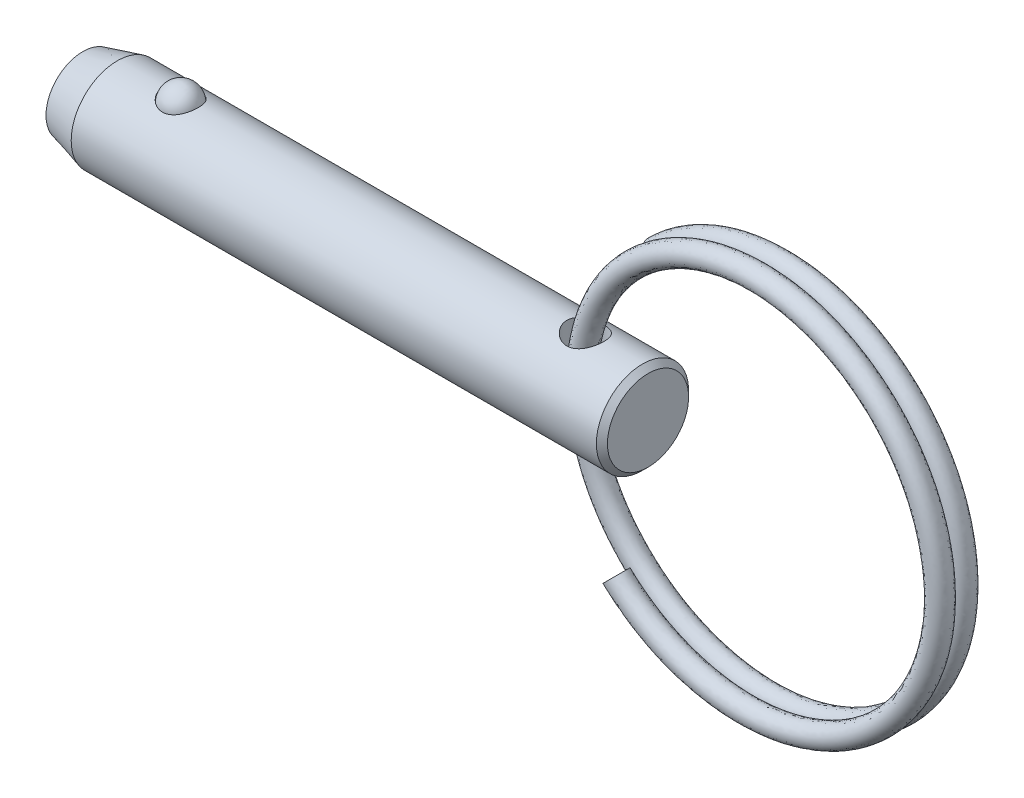
from build123d import *

# Parameters (mm, degrees)
SKETCH4_W          = 1.27
SKETCH4_H          = 6.35
SWEEP1_PITCH       = 1.5494
SWEEP1_HEIGHT      = 1.355725
SWEEP1_RADIUS      = 13.462
SKETCH6_R          = 0.762
SWEEP2_PITCH       = 1.5494
SWEEP2_HEIGHT      = 1.355725
SWEEP2_RADIUS      = 13.462
SWEEP2_START_ANGLE = -180
SKETCH6_2_R        = 0.762


with BuildPart() as part:
    # Sketch1 → Revolve1 (revolve)
    with BuildSketch(Plane.XY, mode=Mode.PRIVATE) as revolve1_sk:
        Polygon((5.588, 2.794), (5.207, 3.175), (-30.954947737, 3.175), (-33.3248, 2.54), (-33.3248, 0), (5.588, 0), align=None)
    revolve(revolve1_sk.sketch.rotate(Axis((5.588, 0, 0), (1, 0, 0)), 90), axis=Axis((5.588, 0, 0), (1, 0, 0)))

    # Sketch2 → Cut-Revolve1 (revolve, cut)
    with BuildSketch(Plane.XY):
        with BuildLine():
            Line((-25.332982051, 2.8575), (-27.847582051, 2.8575))
            ThreePointArc((-27.847582051, 2.8575), (-26.590282051, 4.1148), (-25.332982051, 2.8575))
        make_face()
    revolve(axis=Axis((-25.332982051, 2.8575, 0), (1, 0, 0)), mode=Mode.SUBTRACT)

    # Sketch4 → Cut-Revolve2 (revolve, cut)
    with BuildSketch(Plane.XY, mode=Mode.PRIVATE) as cut_revolve2_sk:
        with Locations((1.905, 0)):
            Rectangle(SKETCH4_W, SKETCH4_H)
    revolve(cut_revolve2_sk.sketch.rotate(Axis((1.27, -3.175, 0), (0, 1, 0)), 90), axis=Axis((1.27, -3.175, 0), (0, 1, 0)), mode=Mode.SUBTRACT)


with BuildPart() as body_2:
    # Sketch3 → Revolve2 (revolve)
    with BuildSketch(Plane.XY):
        with BuildLine():
            Line((-25.358382051, 2.8575), (-27.822182051, 2.8575))
            ThreePointArc((-27.822182051, 2.8575), (-26.590282051, 4.0894), (-25.358382051, 2.8575))
        make_face()
    revolve(axis=Axis((-25.358382051, 2.8575, 0), (1, 0, 0)))


with BuildPart() as body_3:
    # Sweep1: sweep along a helix
    with BuildLine() as sweep1_path:
        Helix(SWEEP1_PITCH, SWEEP1_HEIGHT, SWEEP1_RADIUS, center=(13.755025091, 0, 0), direction=(0, 0, -1), lefthand=True)
    # Sketch6 → Sweep1 (sweep)
    with BuildSketch(Plane(origin=(114.003847968, 0, 0), x_dir=(0, 0, -1), z_dir=(0, 1, 0))):
        with Locations((0, 112.948822877)):
            Circle(SKETCH6_R)
    sweep(path=sweep1_path.line, is_frenet=True)

    # Sweep2: sweep along a helix
    with BuildLine() as sweep2_path:
        add(Helix(SWEEP2_PITCH, SWEEP2_HEIGHT, SWEEP2_RADIUS, center=(13.755025091, 0, 0), direction=(0, 0, 1), lefthand=True, mode=Mode.PRIVATE).rotate(Axis((13.755025091, 0, 0), (0, 0, 1)), SWEEP2_START_ANGLE))
    # Sketch6<2> → Sweep2 (sweep)
    with BuildSketch(Plane(origin=(114.003847968, 0, 0), x_dir=(0, 0, -1), z_dir=(0, 1, 0))):
        with Locations((0, 112.948822877)):
            Circle(SKETCH6_2_R)
    sweep(path=sweep2_path.line, is_frenet=True)


solid = Compound([part.part, body_2.part, body_3.part])
